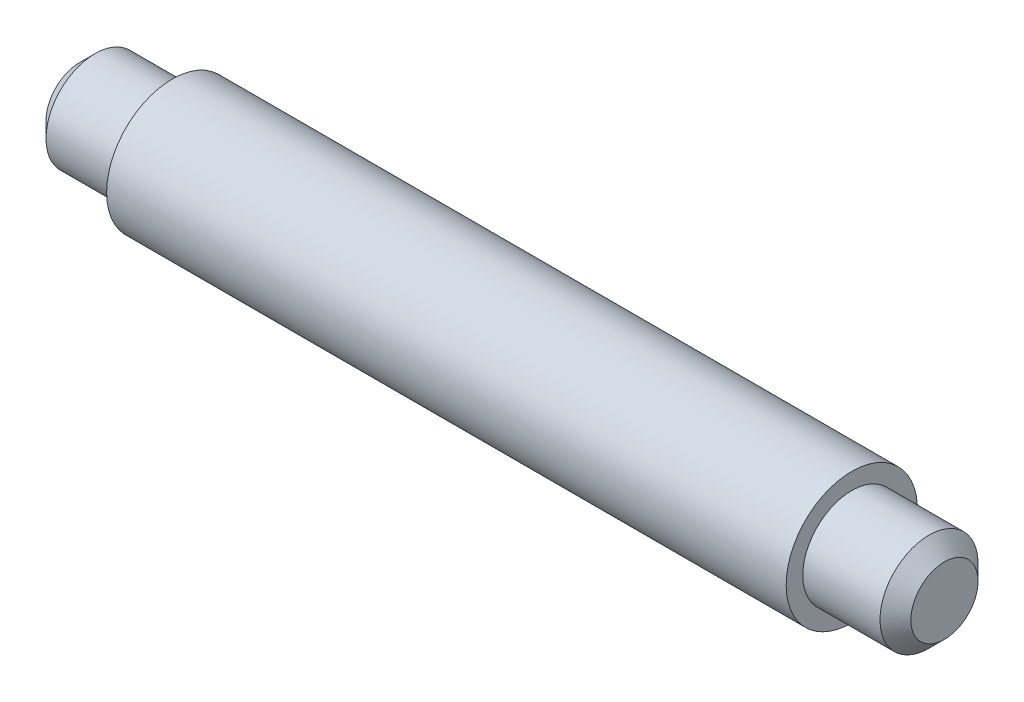
from build123d import *


with BuildPart() as part:
    # Sketch1 → Revolve1 (revolve)
    with BuildSketch(Plane.XY, mode=Mode.PRIVATE) as revolve1_sk:
        Polygon((-28, 0), (-28, 2.175), (-27, 3.175), (-22, 3.175), (-22, 4.25), (22, 4.25), (22, 3.175), (27, 3.175), (28, 2.175), (28, 0), align=None)
    revolve(revolve1_sk.sketch.rotate(Axis((-36.176470588, 0, 0), (1, 0, 0)), 90), axis=Axis((-36.176470588, 0, 0), (1, 0, 0)))


solid = part.part
